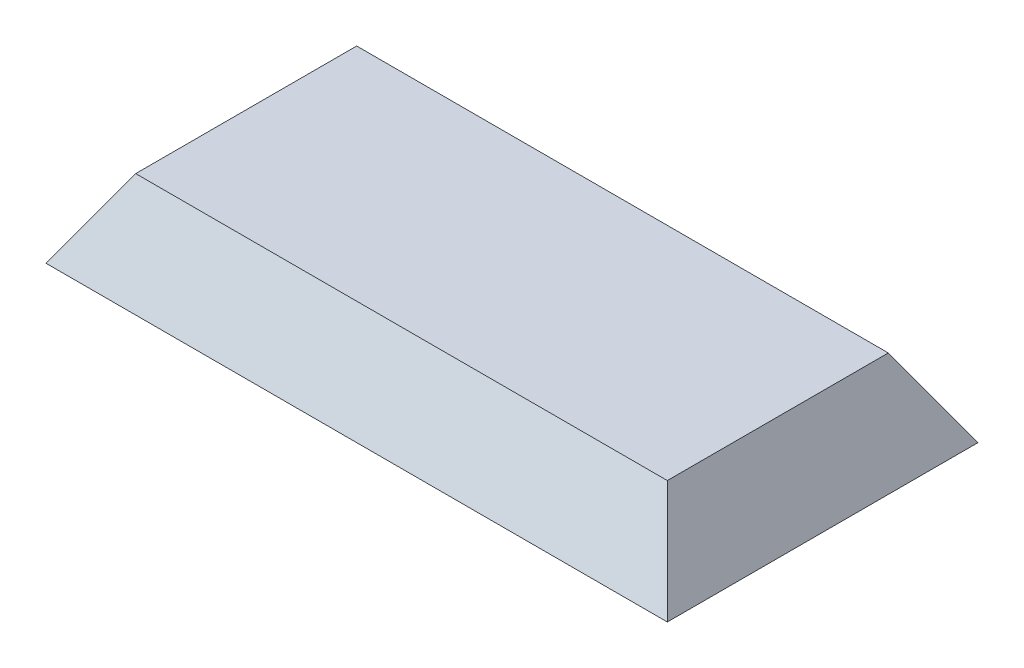
from build123d import *

# Parameters (mm, degrees)
SKETCH1_W           = 80
SKETCH1_H           = 40
BOSS_EXTRUDE1_DEPTH = 10
BOSS_EXTRUDE1_TAPER = 30


with BuildPart() as part:
    # Sketch1 → Boss-Extrude1 (new body)
    with BuildSketch(Plane(origin=(0, 0, 0), x_dir=(1, 0, 0), z_dir=(0, 1, 0))):
        Rectangle(SKETCH1_W, SKETCH1_H)
    extrude(amount=BOSS_EXTRUDE1_DEPTH, taper=BOSS_EXTRUDE1_TAPER)


solid = part.part
